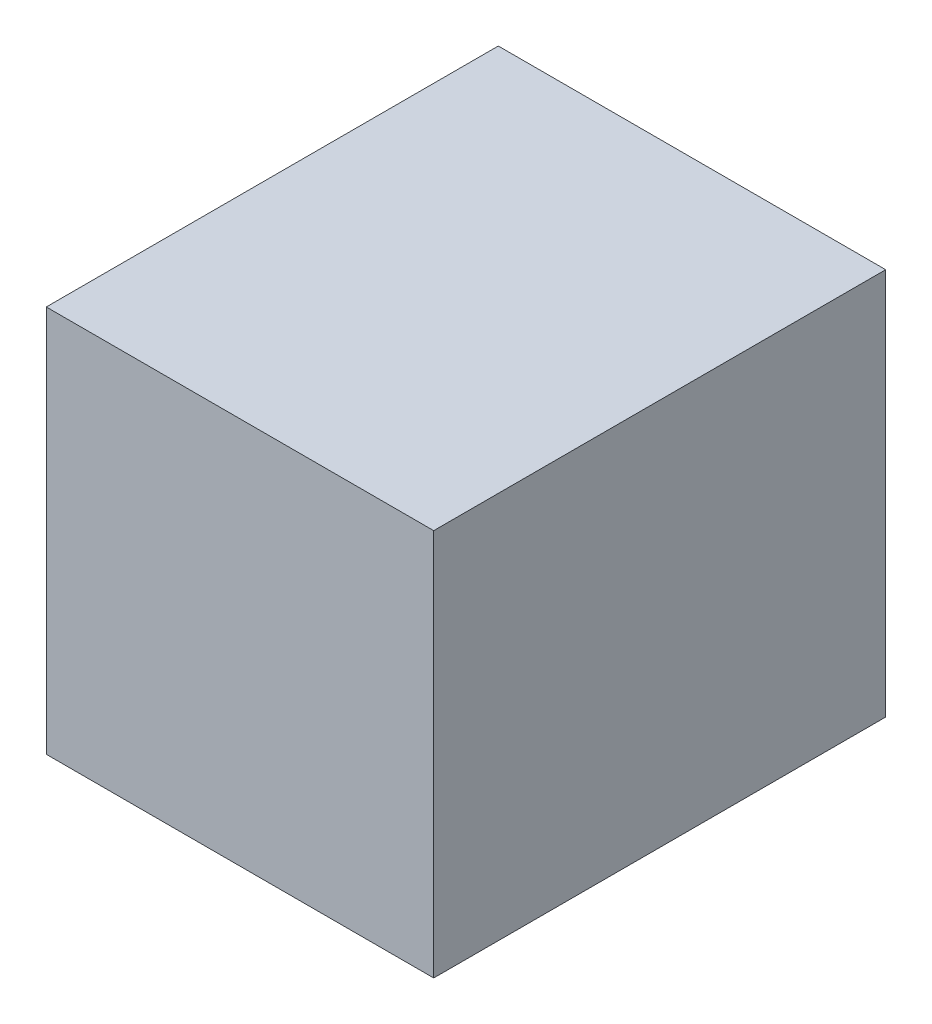
from build123d import *

# Parameters (mm, degrees)
SKETCH1_W           = 600
SKETCH1_H           = 700
BOSS_EXTRUDE1_DEPTH = 600


with BuildPart() as part:
    # Sketch1 → Boss-Extrude1 (new body)
    with BuildSketch(Plane(origin=(0, 0, 0), x_dir=(1, 0, 0), z_dir=(0, 1, 0))):
        Rectangle(SKETCH1_W, SKETCH1_H)
    extrude(amount=BOSS_EXTRUDE1_DEPTH)


solid = part.part
